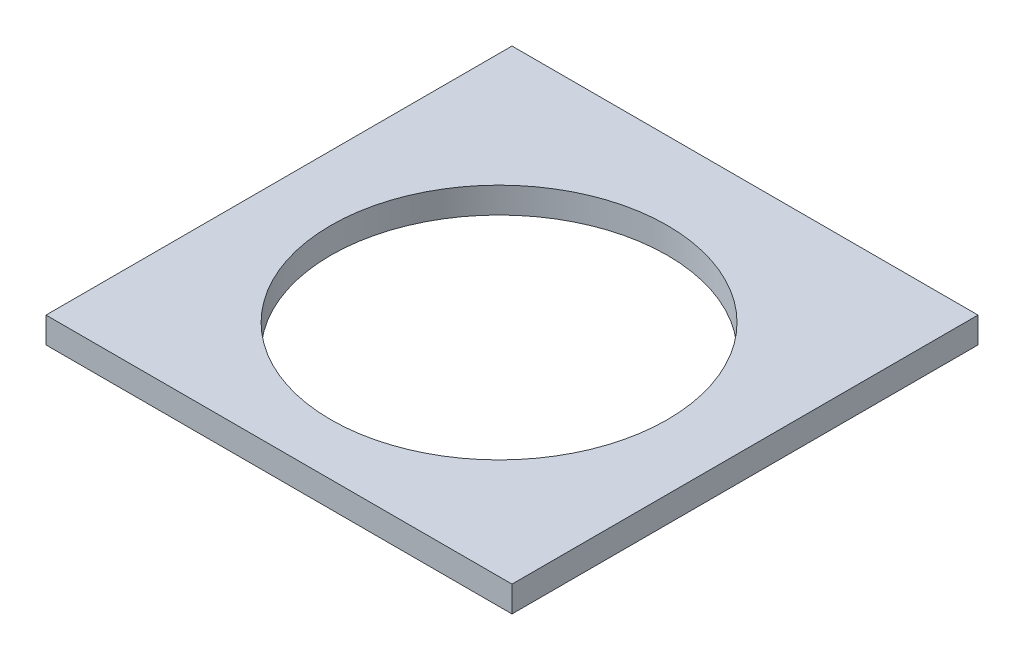
from build123d import *

# Parameters (mm, degrees)
SKETCH_1_W          = 18
SKETCH_1_H          = 18
EXTRUDE_1_DEPTH     = 8
CUT_EXTRUDE_START   = 8
SKETCH_5_W          = 16
SKETCH_5_H          = 17
CUT_EXTRUDE_6_DEPTH = 7
EXTRUDE_START       = 8
SKETCH_6_W          = 18
SKETCH_6_H          = 18
EXTRUDE_2_DEPTH     = 1
CUT_EXTRUDE_START_2 = 9
SKETCH_7_R          = 6.5
CUT_EXTRUDE_7_DEPTH = 1
SKETCH_11_W         = 18
SKETCH_11_H         = 18
CUT_EXTRUDE_9_DEPTH = 8


with BuildPart() as part:
    # 스케치1 → 보스-돌출1 (new body)
    with BuildSketch(Plane(origin=(0, 0, 0), x_dir=(1, 0, 0), z_dir=(0, 1, 0))):
        Rectangle(SKETCH_1_W, SKETCH_1_H)
    extrude(amount=EXTRUDE_1_DEPTH)

    # 스케치5 → 컷-돌출6 (cut)
    with BuildSketch(Plane(origin=(0, 0, 0), x_dir=(1, 0, 0), z_dir=(0, 1, 0)).offset(CUT_EXTRUDE_START)):
        with Locations((0, 0.5)):
            Rectangle(SKETCH_5_W, SKETCH_5_H)
    extrude(amount=-CUT_EXTRUDE_6_DEPTH, mode=Mode.SUBTRACT)

    # 스케치11 → 컷-돌출9 (cut)
    with BuildSketch(Plane.XZ):
        Rectangle(SKETCH_11_W, SKETCH_11_H)
    extrude(amount=-CUT_EXTRUDE_9_DEPTH, mode=Mode.SUBTRACT)


with BuildPart() as body_2:
    # 스케치6 → 보스-돌출2 (new body)
    with BuildSketch(Plane(origin=(0, 0, 0), x_dir=(1, 0, 0), z_dir=(0, 1, 0)).offset(EXTRUDE_START)):
        Rectangle(SKETCH_6_W, SKETCH_6_H)
    extrude(amount=EXTRUDE_2_DEPTH)

    # 스케치7 → 컷-돌출7 (cut)
    with BuildSketch(Plane(origin=(0, 0, 0), x_dir=(1, 0, 0), z_dir=(0, 1, 0)).offset(CUT_EXTRUDE_START_2)):
        with Locations(Location((0, -0.5, 0), (0, 0, 270))):
            Circle(SKETCH_7_R)
    extrude(amount=-CUT_EXTRUDE_7_DEPTH, mode=Mode.SUBTRACT)


solid = body_2.part
